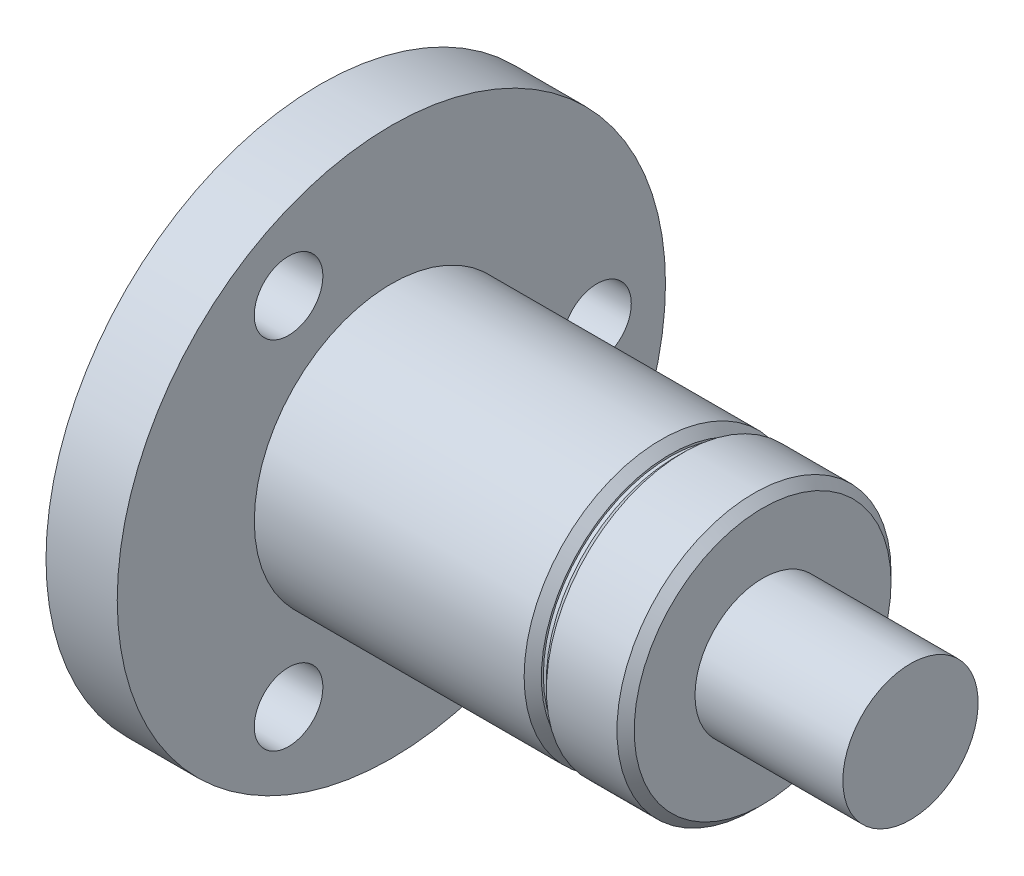
from build123d import *

# Parameters (mm, degrees)
SKETCH1_W          = 6.3
SKETCH1_H          = 3.133597909
SKETCH1_W_2        = 20.5
SKETCH1_W_3        = 6.85
SKETCH2_R          = 1.59
CUT_EXTRUDE1_DEPTH = 10
CIRPATTERN1_COUNT  = 3
CHAMFER1_SIZE      = 0.4


with BuildPart() as part:
    # Sketch1 → Revolve1 (revolve)
    with BuildSketch(Plane.XY, mode=Mode.PRIVATE) as revolve1_sk:
        with Locations((-6.45, 1.566798955)):
            Rectangle(SKETCH1_W, SKETCH1_H)
        with Locations((6.95, 1.566798955)):
            Rectangle(SKETCH1_W_2, SKETCH1_H)
        Polygon((17.2, 3.133597909), (17.2, 6.35), (13.132231879, 6.35), (13.132231879, 5.859469346), (12.9, 5.859469346), (12.9, 6.35), (0, 6.35), (0, 12.7), (-3.3, 12.7), (-3.3, 3.133597909), align=None)
        with Locations((20.625, 1.566798955)):
            Rectangle(SKETCH1_W_3, SKETCH1_H)
    revolve(revolve1_sk.sketch.rotate(Axis((-3.3, 0, 0), (1, 0, 0)), 90), axis=Axis((-3.3, 0, 0), (1, 0, 0)))

    # Sketch2 → Cut-Extrude1 (cut)
    with BuildSketch(Plane(origin=(0, 0, 0), x_dir=(0, 0, -1), z_dir=(1, 0, 0))):
        with Locations((9.525, 0)):
            Circle(SKETCH2_R)
    cut_extrude1 = extrude(amount=-CUT_EXTRUDE1_DEPTH, mode=Mode.SUBTRACT)

    # CirPattern1: Cut-Extrude1 ×3 about axis
    cirpattern1_axis = Axis((0, 0, 0), (1, 0, 0))
    for i in range(1, CIRPATTERN1_COUNT):
        add(cut_extrude1.rotate(cirpattern1_axis, i * 360 / CIRPATTERN1_COUNT), mode=Mode.SUBTRACT)

    # Chamfer1
    chamfer1_edges = [part.edges().sort_by_distance(p)[0] for p in [
        (12.9, 0, -6.35),
        (13.132231879, 0, -6.35),
        (17.2, 0, -6.35),
    ]]
    chamfer(chamfer1_edges, length=CHAMFER1_SIZE)


solid = part.part
